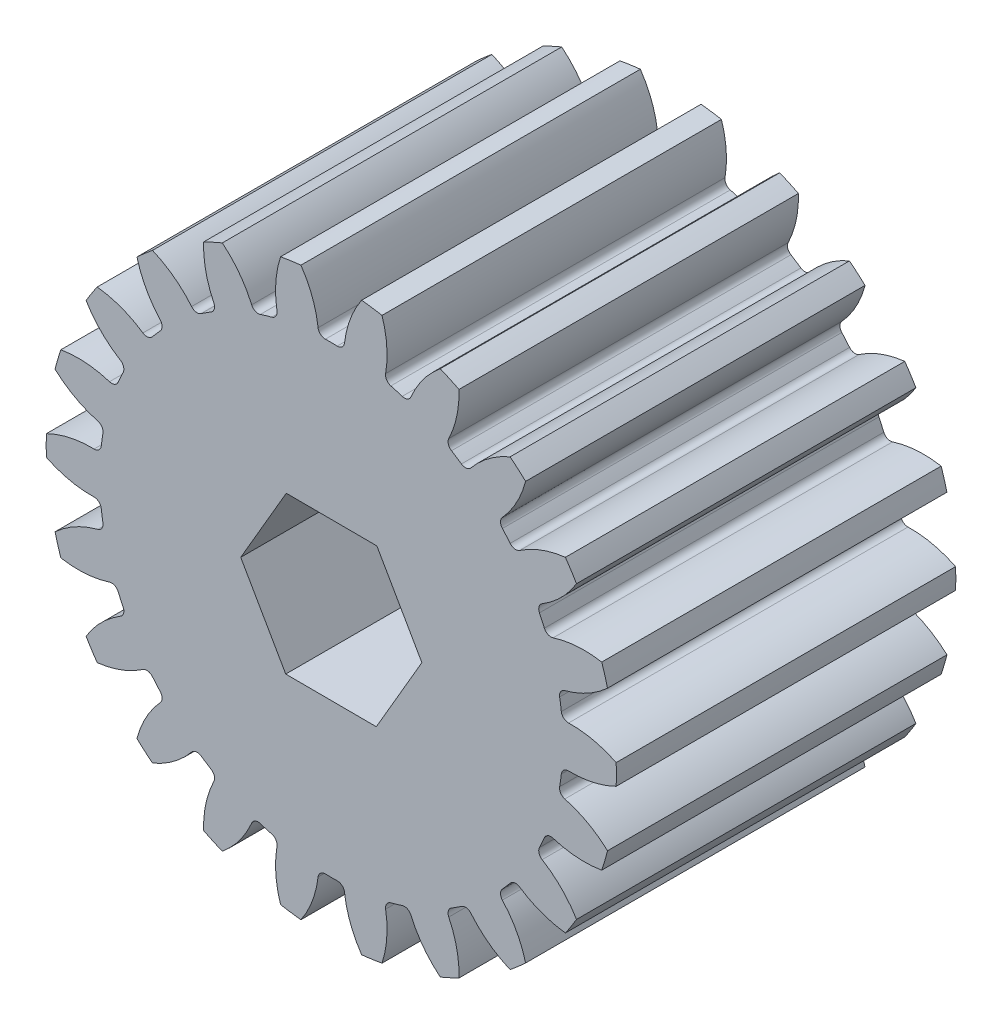
from build123d import *

# Parameters (mm, degrees)
BOSS_EXTRUDE1_DEPTH      = 25.4
BOSS_EXTRUDE1_DEPTH_BACK = 3.175
SKETCH1_R                = 24
CUT_EXTRUDE2_DEPTH       = 45.368126228
FILLET2_R                = 0.6
CIRPATTERN2_COUNT        = 22
FILLET2_OF_CIRPATTERN2_R = 0.6
CUT_EXTRUDE3_DEPTH       = 45.2944261


with BuildPart() as part:
    # Sketch1 → Boss-Extrude1 (new, two sides: drawn at the far end of the back side and taken through both)
    with BuildSketch(Plane.XY.offset(-BOSS_EXTRUDE1_DEPTH_BACK)):
        Circle(SKETCH1_R)
    extrude(amount=BOSS_EXTRUDE1_DEPTH + BOSS_EXTRUDE1_DEPTH_BACK)

    # Sketch3 → Cut-Extrude2 (cut, through all)
    with BuildSketch(Plane(origin=(0, 0, -3.175), x_dir=(-1, 0, 0), z_dir=(0, 0, -1))):
        with BuildLine():
            ThreePointArc((-3.283383383, 24.783449993), (-1.715772066, 22.318455925), (-1.06349074, 19.470978081))
            ThreePointArc((-1.06349074, 19.470978081), (0, 19.5), (1.06349074, 19.470978081))
            ThreePointArc((1.06349074, 19.470978081), (1.715772066, 22.318455925), (3.283383383, 24.783449993))
            ThreePointArc((3.283383383, 24.783449993), (0, 25), (-3.283383383, 24.783449993))
        make_face()
    cut_extrude2 = extrude(amount=-CUT_EXTRUDE2_DEPTH, mode=Mode.SUBTRACT)

    # Fillet2
    fillet2_edges = [part.edges().sort_by_distance(p)[0] for p in [
        (-1.06349074, 19.470978081, 11.1125),
        (1.06349074, 19.470978081, 11.1125),
    ]]
    fillet(fillet2_edges, radius=FILLET2_R)

    # CirPattern2: Cut-Extrude2 ×22 about axis
    cirpattern2_axis = Axis((0, 0, 0), (0, 0, 1))
    for i in range(1, CIRPATTERN2_COUNT):
        add(cut_extrude2.rotate(cirpattern2_axis, i * 360 / CIRPATTERN2_COUNT), mode=Mode.SUBTRACT)

    # Fillet2 of CirPattern2
    fillet2_of_cirpattern2_edges = [part.edges().sort_by_distance(p)[0] for p in [
        (-6.506020331, 18.382646693, 11.1125),
        (-4.465196547, 18.981886624, 11.1125),
        (-11.421470848, 15.805062596, 11.1125),
        (-9.632140165, 16.954995602, 11.1125),
        (-15.411621724, 11.947046323, 11.1125),
        (-14.018745071, 13.554511671, 11.1125),
        (-18.153214663, 7.121151409, 11.1125),
        (-17.269634624, 9.055921816, 11.1125),
        (-19.424142112, 1.718343159, 11.1125),
        (-19.121441087, 3.823675034, 11.1125),
        (-19.121441087, -3.823675034, 11.1125),
        (-19.424142112, -1.718343159, 11.1125),
        (-17.269634624, -9.055921816, 11.1125),
        (-18.153214663, -7.121151409, 11.1125),
        (-14.018745071, -13.554511671, 11.1125),
        (-15.411621724, -11.947046323, 11.1125),
        (-9.632140165, -16.954995602, 11.1125),
        (-11.421470848, -15.805062596, 11.1125),
        (-4.465196547, -18.981886624, 11.1125),
        (-6.506020331, -18.382646693, 11.1125),
        (1.06349074, -19.470978081, 11.1125),
        (-1.06349074, -19.470978081, 11.1125),
        (6.506020331, -18.382646693, 11.1125),
        (4.465196547, -18.981886624, 11.1125),
        (11.421470848, -15.805062596, 11.1125),
        (9.632140165, -16.954995602, 11.1125),
        (15.411621724, -11.947046323, 11.1125),
        (14.018745071, -13.554511671, 11.1125),
        (18.153214663, -7.121151409, 11.1125),
        (17.269634624, -9.055921816, 11.1125),
        (19.424142112, -1.718343159, 11.1125),
        (19.121441087, -3.823675034, 11.1125),
        (19.121441087, 3.823675034, 11.1125),
        (19.424142112, 1.718343159, 11.1125),
        (17.269634624, 9.055921816, 11.1125),
        (18.153214663, 7.121151409, 11.1125),
        (14.018745071, 13.554511671, 11.1125),
        (15.411621724, 11.947046323, 11.1125),
        (9.632140165, 16.954995602, 11.1125),
        (11.421470848, 15.805062596, 11.1125),
        (4.465196547, 18.981886624, 11.1125),
        (6.506020331, 18.382646693, 11.1125),
    ]]
    fillet(fillet2_of_cirpattern2_edges, radius=FILLET2_OF_CIRPATTERN2_R)

    # Sketch4 → Cut-Extrude3 (cut, through all)
    with BuildSketch(Plane.XY.offset(25.4)):
        Polygon((3.836203431, 6.590444945), (-3.789391029, 6.617472098), (-7.62559446, 0.027027153), (-3.836203431, -6.590444945), (3.789391029, -6.617472098), (7.62559446, -0.027027153), align=None)
    extrude(amount=-CUT_EXTRUDE3_DEPTH, mode=Mode.SUBTRACT)


solid = part.part
